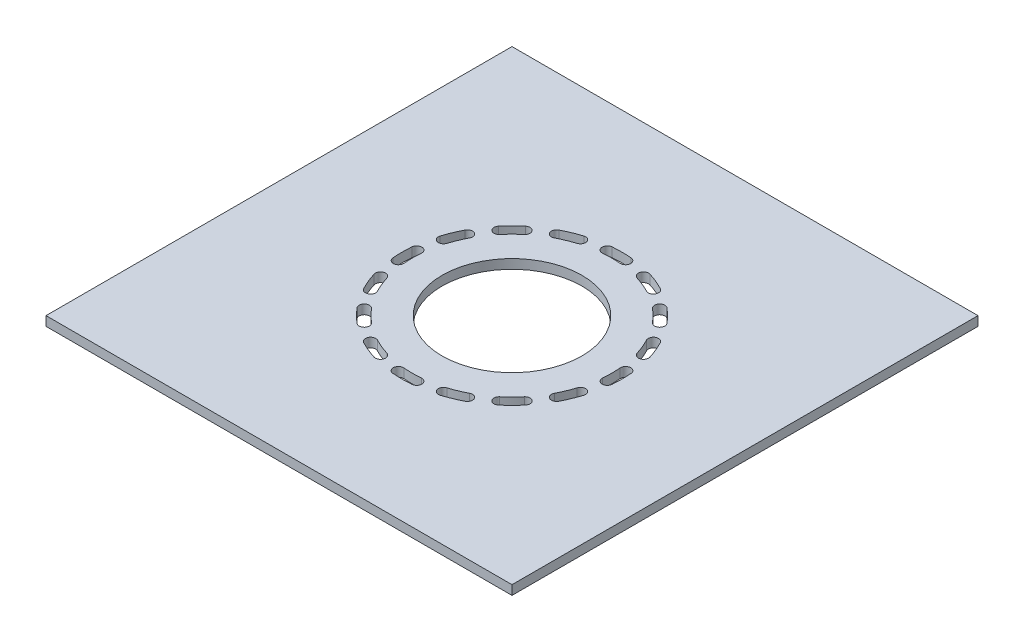
from build123d import *

# Parameters (mm, degrees)
SKETCH_1_W      = 100
SKETCH_1_H      = 100
SKETCH_1_R      = 15
EXTRUDE_1_DEPTH = 2


with BuildPart() as part:
    # 草图1 → 凸台-拉伸1 (new body)
    with BuildSketch(Plane(origin=(0, 0, 0), x_dir=(1, 0, 0), z_dir=(0, 1, 0))):
        Rectangle(SKETCH_1_W, SKETCH_1_H)
        with Locations(Location((0, 0, 0), (0, 0, 270))):
            Circle(SKETCH_1_R, mode=Mode.SUBTRACT)
        with BuildLine():
            ThreePointArc((16.393351083, 13.755654847), (15.132085117, 15.132085117), (13.755654847, 16.393351083))
            ThreePointArc((13.755654847, 16.393351083), (13.620072331, 17.943066341), (15.169787589, 18.078648858))
            ThreePointArc((15.169787589, 18.078648858), (16.687720036, 16.687720036), (18.078648858, 15.169787589))
            ThreePointArc((18.078648858, 15.169787589), (17.943066341, 13.620072331), (16.393351083, 13.755654847))
        make_face(mode=Mode.SUBTRACT)
        with BuildLine():
            ThreePointArc((20.933455663, 10.897267272), (19.449820272, 11.365055714), (18.98203183, 9.881420323))
            ThreePointArc((18.98203183, 9.881420323), (19.771021996, 8.189425453), (20.409542746, 6.435104109))
            ThreePointArc((20.409542746, 6.435104109), (21.789407771, 5.716791843), (22.507720038, 7.096656868))
            ThreePointArc((22.507720038, 7.096656868), (21.803556967, 9.031329004), (20.933455663, 10.897267272))
        make_face(mode=Mode.SUBTRACT)
        with BuildLine():
            ThreePointArc((23.510194875, 2.056875529), (22.31850939, 3.05681838), (21.318566539, 1.865132895))
            ThreePointArc((21.318566539, 1.865132895), (21.4, 0), (21.318566539, -1.865132895))
            ThreePointArc((21.318566539, -1.865132895), (22.31850939, -3.05681838), (23.510194875, -2.056875529))
            ThreePointArc((23.510194875, -2.056875529), (23.6, 0), (23.510194875, 2.056875529))
        make_face(mode=Mode.SUBTRACT)
        with BuildLine():
            ThreePointArc((22.507720038, -7.096656868), (21.789407771, -5.716791843), (20.409542746, -6.435104109))
            ThreePointArc((20.409542746, -6.435104109), (19.771021996, -8.189425453), (18.98203183, -9.881420323))
            ThreePointArc((18.98203183, -9.881420323), (19.449820272, -11.365055714), (20.933455663, -10.897267272))
            ThreePointArc((20.933455663, -10.897267272), (21.803556967, -9.031329004), (22.507720038, -7.096656868))
        make_face(mode=Mode.SUBTRACT)
        with BuildLine():
            ThreePointArc((18.078648858, -15.169787589), (17.943066341, -13.620072331), (16.393351083, -13.755654847))
            ThreePointArc((16.393351083, -13.755654847), (15.132085117, -15.132085117), (13.755654847, -16.393351083))
            ThreePointArc((13.755654847, -16.393351083), (13.620072331, -17.943066341), (15.169787589, -18.078648858))
            ThreePointArc((15.169787589, -18.078648858), (16.687720036, -16.687720036), (18.078648858, -15.169787589))
        make_face(mode=Mode.SUBTRACT)
        with BuildLine():
            ThreePointArc((10.897267272, -20.933455663), (11.365055714, -19.449820272), (9.881420323, -18.98203183))
            ThreePointArc((9.881420323, -18.98203183), (8.189425453, -19.771021996), (6.435104109, -20.409542746))
            ThreePointArc((6.435104109, -20.409542746), (5.716791843, -21.789407771), (7.096656868, -22.507720038))
            ThreePointArc((7.096656868, -22.507720038), (9.031329004, -21.803556967), (10.897267272, -20.933455663))
        make_face(mode=Mode.SUBTRACT)
        with BuildLine():
            ThreePointArc((2.056875529, -23.510194875), (3.05681838, -22.31850939), (1.865132895, -21.318566539))
            ThreePointArc((1.865132895, -21.318566539), (0, -21.4), (-1.865132895, -21.318566539))
            ThreePointArc((-1.865132895, -21.318566539), (-3.05681838, -22.31850939), (-2.056875529, -23.510194875))
            ThreePointArc((-2.056875529, -23.510194875), (0, -23.6), (2.056875529, -23.510194875))
        make_face(mode=Mode.SUBTRACT)
        with BuildLine():
            ThreePointArc((-7.096656868, -22.507720038), (-5.716791843, -21.789407771), (-6.435104109, -20.409542746))
            ThreePointArc((-6.435104109, -20.409542746), (-8.189425453, -19.771021996), (-9.881420323, -18.98203183))
            ThreePointArc((-9.881420323, -18.98203183), (-11.365055714, -19.449820272), (-10.897267272, -20.933455663))
            ThreePointArc((-10.897267272, -20.933455663), (-9.031329004, -21.803556967), (-7.096656868, -22.507720038))
        make_face(mode=Mode.SUBTRACT)
        with BuildLine():
            ThreePointArc((-15.169787589, -18.078648858), (-13.620072331, -17.943066341), (-13.755654847, -16.393351083))
            ThreePointArc((-13.755654847, -16.393351083), (-15.132085117, -15.132085117), (-16.393351083, -13.755654847))
            ThreePointArc((-16.393351083, -13.755654847), (-17.943066341, -13.620072331), (-18.078648858, -15.169787589))
            ThreePointArc((-18.078648858, -15.169787589), (-16.687720036, -16.687720036), (-15.169787589, -18.078648858))
        make_face(mode=Mode.SUBTRACT)
        with BuildLine():
            ThreePointArc((-20.933455663, -10.897267272), (-19.449820272, -11.365055714), (-18.98203183, -9.881420323))
            ThreePointArc((-18.98203183, -9.881420323), (-19.771021996, -8.189425453), (-20.409542746, -6.435104109))
            ThreePointArc((-20.409542746, -6.435104109), (-21.789407771, -5.716791843), (-22.507720038, -7.096656868))
            ThreePointArc((-22.507720038, -7.096656868), (-21.803556967, -9.031329004), (-20.933455663, -10.897267272))
        make_face(mode=Mode.SUBTRACT)
        with BuildLine():
            ThreePointArc((-23.510194875, -2.056875529), (-22.31850939, -3.05681838), (-21.318566539, -1.865132895))
            ThreePointArc((-21.318566539, -1.865132895), (-21.4, 0), (-21.318566539, 1.865132895))
            ThreePointArc((-21.318566539, 1.865132895), (-22.31850939, 3.05681838), (-23.510194875, 2.056875529))
            ThreePointArc((-23.510194875, 2.056875529), (-23.6, 0), (-23.510194875, -2.056875529))
        make_face(mode=Mode.SUBTRACT)
        with BuildLine():
            ThreePointArc((-22.507720038, 7.096656868), (-21.789407771, 5.716791843), (-20.409542746, 6.435104109))
            ThreePointArc((-20.409542746, 6.435104109), (-19.771021996, 8.189425453), (-18.98203183, 9.881420323))
            ThreePointArc((-18.98203183, 9.881420323), (-19.449820272, 11.365055714), (-20.933455663, 10.897267272))
            ThreePointArc((-20.933455663, 10.897267272), (-21.803556967, 9.031329004), (-22.507720038, 7.096656868))
        make_face(mode=Mode.SUBTRACT)
        with BuildLine():
            ThreePointArc((-18.078648858, 15.169787589), (-17.943066341, 13.620072331), (-16.393351083, 13.755654847))
            ThreePointArc((-16.393351083, 13.755654847), (-15.132085117, 15.132085117), (-13.755654847, 16.393351083))
            ThreePointArc((-13.755654847, 16.393351083), (-13.620072331, 17.943066341), (-15.169787589, 18.078648858))
            ThreePointArc((-15.169787589, 18.078648858), (-16.687720036, 16.687720036), (-18.078648858, 15.169787589))
        make_face(mode=Mode.SUBTRACT)
        with BuildLine():
            ThreePointArc((-10.897267272, 20.933455663), (-11.365055714, 19.449820272), (-9.881420323, 18.98203183))
            ThreePointArc((-9.881420323, 18.98203183), (-8.189425453, 19.771021996), (-6.435104109, 20.409542746))
            ThreePointArc((-6.435104109, 20.409542746), (-5.716791843, 21.789407771), (-7.096656868, 22.507720038))
            ThreePointArc((-7.096656868, 22.507720038), (-9.031329004, 21.803556967), (-10.897267272, 20.933455663))
        make_face(mode=Mode.SUBTRACT)
        with BuildLine():
            ThreePointArc((-2.056875529, 23.510194875), (-3.05681838, 22.31850939), (-1.865132895, 21.318566539))
            ThreePointArc((-1.865132895, 21.318566539), (0, 21.4), (1.865132895, 21.318566539))
            ThreePointArc((1.865132895, 21.318566539), (3.05681838, 22.31850939), (2.056875529, 23.510194875))
            ThreePointArc((2.056875529, 23.510194875), (0, 23.6), (-2.056875529, 23.510194875))
        make_face(mode=Mode.SUBTRACT)
        with BuildLine():
            ThreePointArc((7.096656868, 22.507720038), (5.716791843, 21.789407771), (6.435104109, 20.409542746))
            ThreePointArc((6.435104109, 20.409542746), (8.189425453, 19.771021996), (9.881420323, 18.98203183))
            ThreePointArc((9.881420323, 18.98203183), (11.365055714, 19.449820272), (10.897267272, 20.933455663))
            ThreePointArc((10.897267272, 20.933455663), (9.031329004, 21.803556967), (7.096656868, 22.507720038))
        make_face(mode=Mode.SUBTRACT)
    extrude(amount=EXTRUDE_1_DEPTH)


solid = part.part
